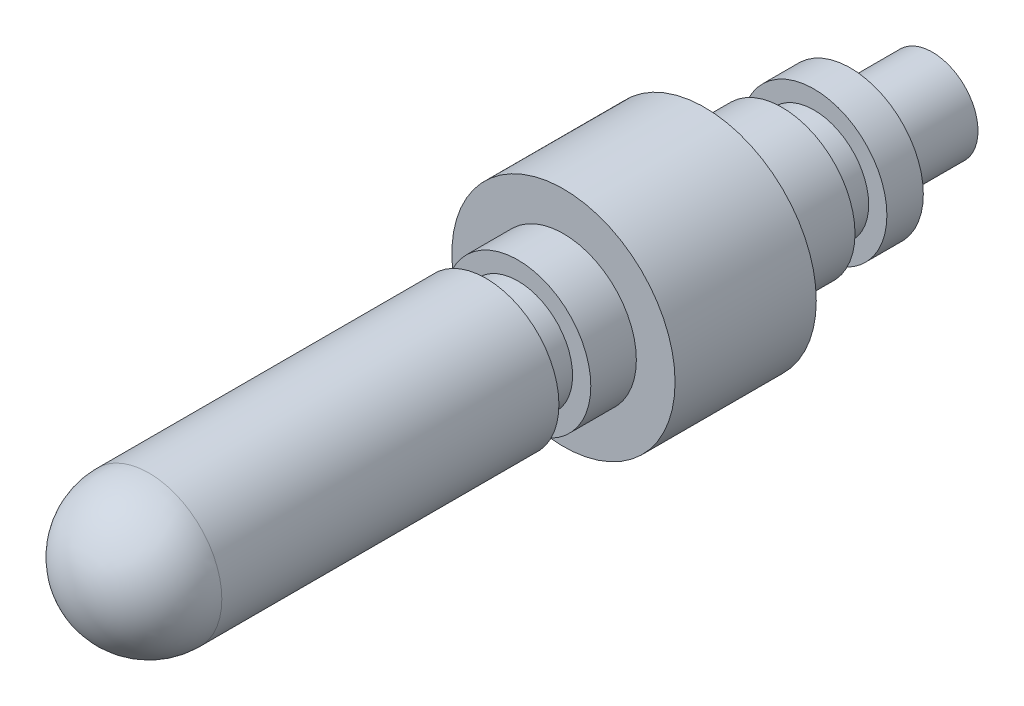
from build123d import *

# Parameters (mm, degrees)
SKETCH1_R           = 1.27
BOSS_EXTRUDE1_DEPTH = 2.286
SKETCH2_R           = 2.032
BOSS_EXTRUDE2_DEPTH = 1.016
SKETCH3_R           = 1.524
BOSS_EXTRUDE3_DEPTH = 0.889
SKETCH4_R           = 2.032
BOSS_EXTRUDE4_DEPTH = 2.159
SKETCH6_R           = 3.1115
BOSS_EXTRUDE5_DEPTH = 3.937
SKETCH7_R           = 2.032
BOSS_EXTRUDE6_DEPTH = 1.27
SKETCH8_R           = 1.524
BOSS_EXTRUDE7_DEPTH = 0.889
SKETCH9_R           = 2.032
BOSS_EXTRUDE8_DEPTH = 11.43
FILLET1_R           = 2.032


with BuildPart() as part:
    # Sketch1 → Boss-Extrude1 (new body)
    with BuildSketch(Plane.XY):
        Circle(SKETCH1_R)
    extrude(amount=BOSS_EXTRUDE1_DEPTH)

    # Sketch2 → Boss-Extrude2 (add)
    with BuildSketch(Plane.XY.offset(2.286)):
        Circle(SKETCH2_R)
    extrude(amount=BOSS_EXTRUDE2_DEPTH)

    # Sketch3 → Boss-Extrude3 (add)
    with BuildSketch(Plane.XY.offset(3.302)):
        Circle(SKETCH3_R)
    extrude(amount=BOSS_EXTRUDE3_DEPTH)

    # Sketch4 → Boss-Extrude4 (add)
    with BuildSketch(Plane.XY.offset(4.191)):
        Circle(SKETCH4_R)
    extrude(amount=BOSS_EXTRUDE4_DEPTH)

    # Sketch6 → Boss-Extrude5 (add)
    with BuildSketch(Plane.XY.offset(6.35)):
        Circle(SKETCH6_R)
    extrude(amount=BOSS_EXTRUDE5_DEPTH)

    # Sketch7 → Boss-Extrude6 (add)
    with BuildSketch(Plane.XY.offset(10.287)):
        Circle(SKETCH7_R)
    extrude(amount=BOSS_EXTRUDE6_DEPTH)

    # Sketch8 → Boss-Extrude7 (add)
    with BuildSketch(Plane.XY.offset(11.557)):
        Circle(SKETCH8_R)
    extrude(amount=BOSS_EXTRUDE7_DEPTH)

    # Sketch9 → Boss-Extrude8 (add)
    with BuildSketch(Plane.XY.offset(12.446)):
        Circle(SKETCH9_R)
    extrude(amount=BOSS_EXTRUDE8_DEPTH)

    # Fillet1
    fillet1_edges = [part.edges().sort_by_distance(p)[0] for p in [
        (-2.032, 0, 23.876),
    ]]
    fillet(fillet1_edges, radius=FILLET1_R)


solid = part.part
